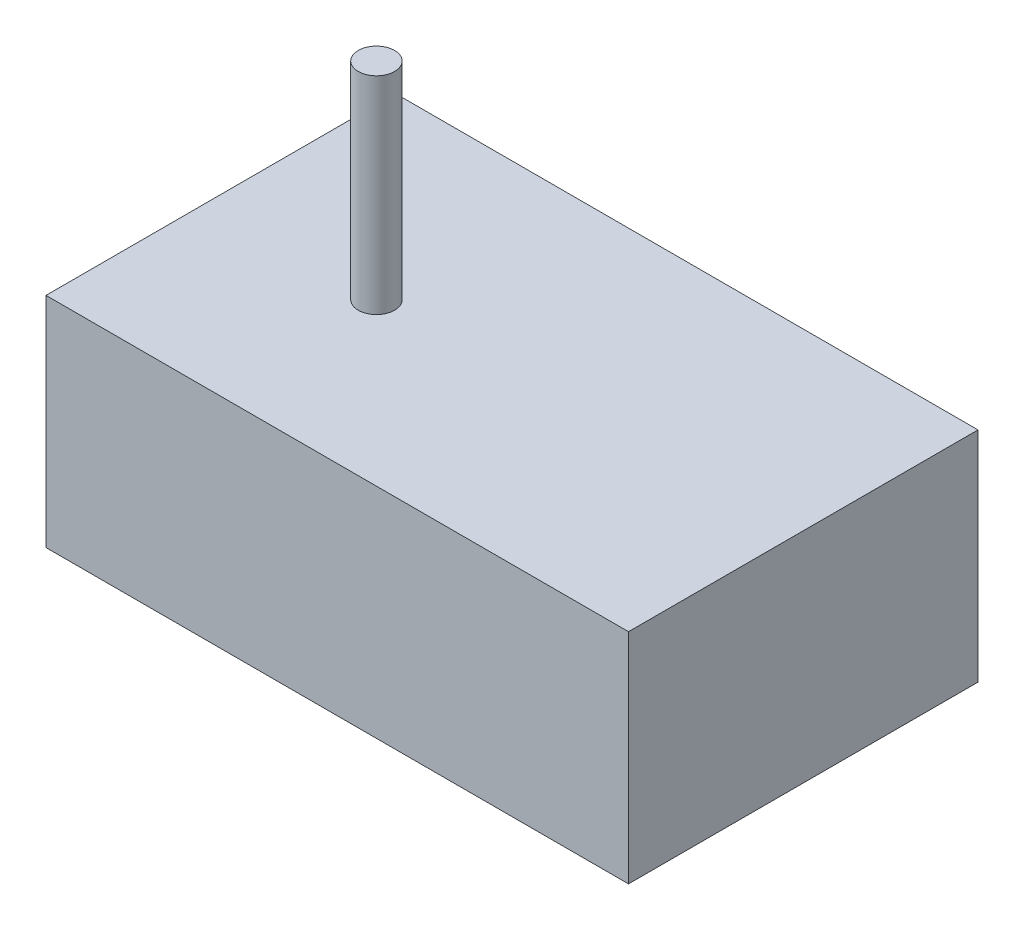
from build123d import *

# Parameters (mm, degrees)
SKETCH1_W                 = 101.6
SKETCH1_H                 = 60.96
SKETCH1_R                 = 3.175
BOSS_EXTRUDE1_DEPTH       = 2.54
SKETCH2_R                 = 3.197303881
CUT_EXTRUDE1_DEPTH        = 2.54
BOSS_EXTRUDE2_DEPTH       = 30.48
BOSS_EXTRUDE2_DEPTH_BACK  = 5.08
SKETCH3_R                 = 3.197303881
SKETCH6_W                 = 2.54
SKETCH6_H                 = 60.96
BOSS_EXTRUDE10_DEPTH      = 33.02
SKETCH7_W                 = 96.52
SKETCH7_H                 = 2.54
BOSS_EXTRUDE11_DEPTH      = 33.02
SKETCH9_W                 = 101.6
SKETCH9_H                 = 60.96
BOSS_EXTRUDE12_DEPTH      = 2.54
BOSS_EXTRUDE13_DEPTH      = 36.068
BOSS_EXTRUDE13_DEPTH_BACK = 12.7
SKETCH10_R                = 3.175


with BuildPart() as part:
    # Sketch1 → Boss-Extrude1 (new body)
    with BuildSketch(Plane(origin=(0, 0, 0), x_dir=(1, 0, 0), z_dir=(0, 1, 0))):
        Rectangle(SKETCH1_W, SKETCH1_H)
        with Locations(Location((-31.75, -2.54, 0), (0, 0, 270))):
            Circle(SKETCH1_R, mode=Mode.SUBTRACT)
    extrude(amount=BOSS_EXTRUDE1_DEPTH)

    # Sketch2 → Cut-Extrude1 (cut)
    with BuildSketch(Plane(origin=(0, 2.54, 0), x_dir=(1, 0, 0), z_dir=(0, 1, 0))):
        with Locations(Location((-0.087463015, 0.456757565, 0), (0, 0, 270))):
            Circle(SKETCH2_R)
    extrude(amount=-CUT_EXTRUDE1_DEPTH, mode=Mode.SUBTRACT)

    # Sketch3 → Boss-Extrude2 (add, two sides: drawn at the far end of the back side and taken through both)
    with BuildSketch(Plane(origin=(0, 2.54, 0), x_dir=(1, 0, 0), z_dir=(0, 1, 0)).offset(-BOSS_EXTRUDE2_DEPTH_BACK)):
        with Locations(Location((-0.087463015, 0.456757565, 0), (0, 0, 270))):
            Circle(SKETCH3_R)
    extrude(amount=BOSS_EXTRUDE2_DEPTH + BOSS_EXTRUDE2_DEPTH_BACK)

    # Sketch6 → Boss-Extrude10 (add)
    with BuildSketch(Plane(origin=(0, 2.54, 0), x_dir=(1, 0, 0), z_dir=(0, 1, 0))):
        with Locations((-49.53, 0)):
            Rectangle(SKETCH6_W, SKETCH6_H)
        with Locations((49.53, 0)):
            Rectangle(SKETCH6_W, SKETCH6_H)
    extrude(amount=BOSS_EXTRUDE10_DEPTH)

    # Sketch7 → Boss-Extrude11 (add)
    with BuildSketch(Plane(origin=(0, 2.54, 0), x_dir=(1, 0, 0), z_dir=(0, 1, 0))):
        with Locations((0, 29.21)):
            Rectangle(SKETCH7_W, SKETCH7_H)
        with Locations((0, -29.21)):
            Rectangle(SKETCH7_W, SKETCH7_H)
    extrude(amount=BOSS_EXTRUDE11_DEPTH)

    # Sketch9 → Boss-Extrude12 (add)
    with BuildSketch(Plane(origin=(0, 35.56, 0), x_dir=(1, 0, 0), z_dir=(0, 1, 0))):
        Rectangle(SKETCH9_W, SKETCH9_H)
    extrude(amount=BOSS_EXTRUDE12_DEPTH)

    # Sketch10 → Boss-Extrude13 (add, two sides: drawn at the far end of the back side and taken through both)
    with BuildSketch(Plane(origin=(0, 38.1, 0), x_dir=(1, 0, 0), z_dir=(0, 1, 0)).offset(-BOSS_EXTRUDE13_DEPTH_BACK)):
        with Locations(Location((-21.325114791, -2.320034183, 0), (0, 0, 270))):
            Circle(SKETCH10_R)
    extrude(amount=BOSS_EXTRUDE13_DEPTH + BOSS_EXTRUDE13_DEPTH_BACK)


solid = part.part
